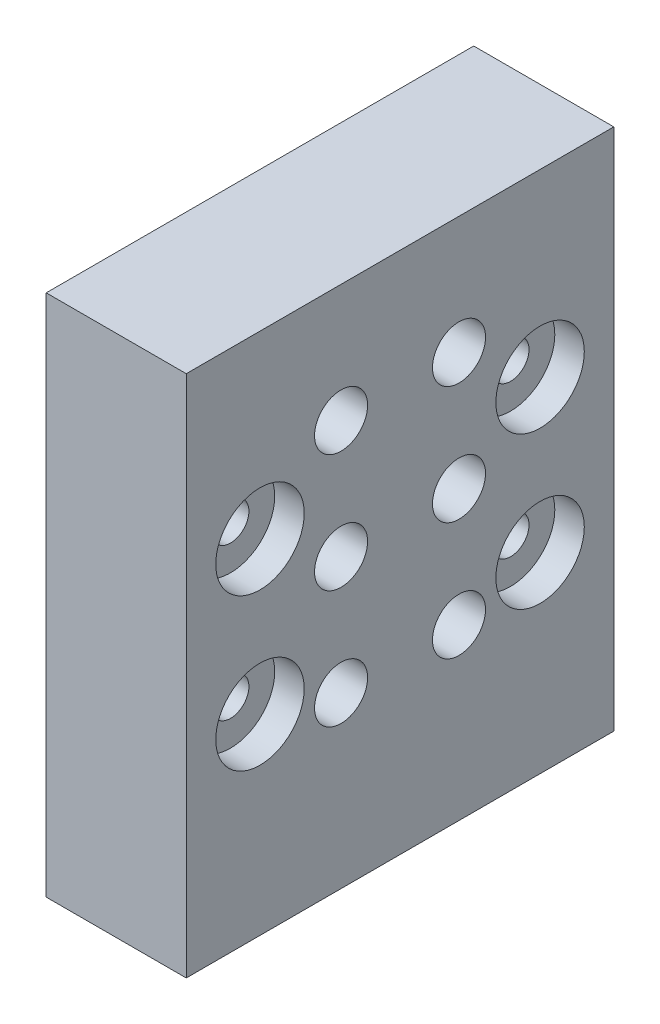
from build123d import *

# Parameters (mm, degrees)
SKETCH_1_W          = 25
SKETCH_1_H          = 31.5
EXTRUDE_1_DEPTH     = 2
SKETCH_2_R          = 1.25
CUT_EXTRUDE_1_DEPTH = 5
SKETCH_3_W          = 2
SKETCH_3_H          = 31.5
EXTRUDE_2_DEPTH     = 2
SKETCH_4_W          = 2
SKETCH_4_H          = 31.5
EXTRUDE_3_DEPTH     = 2
SKETCH_5_W          = 2
SKETCH_5_H          = 31.5
EXTRUDE_4_DEPTH     = 2
SKETCH_6_W          = 2
SKETCH_6_H          = 31.5
EXTRUDE_5_DEPTH     = 2
SKETCH_7_W          = 4
SKETCH_7_H          = 29
EXTRUDE_6_DEPTH     = 2
SKETCH_8_W          = 4
SKETCH_8_H          = 29
EXTRUDE_7_DEPTH     = 2
EXTRUDE_START       = 3
SKETCH_9_W          = 29
SKETCH_9_H          = 35.5
SKETCH_9_R          = 1.25
EXTRUDE_8_DEPTH     = 3
EXTRUDE_START_2     = 2.5
SKETCH_11_W         = 29
SKETCH_11_H         = 35.5
SKETCH_11_R         = 1.25
EXTRUDE_9_DEPTH     = 2.5
SKETCH_12_R         = 1.8
CUT_EXTRUDE_2_DEPTH = 13.5
SKETCH_13_R         = 3
CUT_EXTRUDE_3_DEPTH = 2


with BuildPart() as part:
    # 草圖1 → 填料-伸長1 (new body)
    with BuildSketch(Plane(origin=(0, 0, 0), x_dir=(0, 0, -1), z_dir=(1, 0, 0))):
        with Locations((12.5, 15.75)):
            Rectangle(SKETCH_1_W, SKETCH_1_H)
    extrude(amount=EXTRUDE_1_DEPTH)

    # 草圖2 → 除料-伸長1 (cut)
    with BuildSketch(Plane(origin=(2, 0, 0), x_dir=(0, 0, -1), z_dir=(1, 0, 0))):
        with Locations((22, 21.3)):
            Circle(SKETCH_2_R)
        with Locations((22, 11)):
            Circle(SKETCH_2_R)
        with Locations((3, 21.3)):
            Circle(SKETCH_2_R)
        with Locations((3, 11)):
            Circle(SKETCH_2_R)
    extrude(amount=-CUT_EXTRUDE_1_DEPTH, mode=Mode.SUBTRACT)

    # 草圖3 → 填料-伸長2 (add)
    with BuildSketch(Plane.XY):
        with Locations((1, 15.75)):
            Rectangle(SKETCH_3_W, SKETCH_3_H)
    extrude(amount=EXTRUDE_2_DEPTH)

    # 草圖4 → 填料-伸長3 (add)
    with BuildSketch(Plane(origin=(0, 0, -25), x_dir=(-1, 0, 0), z_dir=(0, 0, -1))):
        with Locations((-1, 15.75)):
            Rectangle(SKETCH_4_W, SKETCH_4_H)
    extrude(amount=EXTRUDE_3_DEPTH)

    # 草圖5 → 填料-伸長4 (add)
    with BuildSketch(Plane.ZY):
        with Locations((-26, 15.75)):
            Rectangle(SKETCH_5_W, SKETCH_5_H)
    extrude(amount=EXTRUDE_4_DEPTH)

    # 草圖6 → 填料-伸長5 (add)
    with BuildSketch(Plane.ZY):
        with Locations((1, 15.75)):
            Rectangle(SKETCH_6_W, SKETCH_6_H)
    extrude(amount=EXTRUDE_5_DEPTH)

    # 草圖7 → 填料-伸長6 (add)
    with BuildSketch(Plane(origin=(0, 31.5, 0), x_dir=(1, 0, 0), z_dir=(0, 1, 0))):
        with Locations((0, 12.5)):
            Rectangle(SKETCH_7_W, SKETCH_7_H)
    extrude(amount=EXTRUDE_6_DEPTH)

    # 草圖8 → 填料-伸長7 (add)
    with BuildSketch(Plane(origin=(0, 0, 0), x_dir=(-1, 0, 0), z_dir=(0, -1, 0))):
        with Locations((0, 12.5)):
            Rectangle(SKETCH_8_W, SKETCH_8_H)
    extrude(amount=EXTRUDE_7_DEPTH)

    # 草圖9 → 填料-伸長8 (add)
    with BuildSketch(Plane(origin=(2, 0, 0), x_dir=(0, 0, -1), z_dir=(1, 0, 0)).offset(EXTRUDE_START)):
        with Locations((12.5, 15.75)):
            Rectangle(SKETCH_9_W, SKETCH_9_H)
        with Locations((3, 21.3)):
            Circle(SKETCH_9_R, mode=Mode.SUBTRACT)
        with Locations((22, 21.3)):
            Circle(SKETCH_9_R, mode=Mode.SUBTRACT)
        with Locations((22, 11)):
            Circle(SKETCH_9_R, mode=Mode.SUBTRACT)
        with Locations((3, 11)):
            Circle(SKETCH_9_R, mode=Mode.SUBTRACT)
    extrude(amount=-EXTRUDE_8_DEPTH)

    # 草圖11 → 填料-伸長9 (add)
    with BuildSketch(Plane(origin=(5, 0, 0), x_dir=(0, 0, -1), z_dir=(1, 0, 0)).offset(EXTRUDE_START_2)):
        with Locations((12.5, 15.75)):
            Rectangle(SKETCH_11_W, SKETCH_11_H)
        with Locations((3, 21.3)):
            Circle(SKETCH_11_R, mode=Mode.SUBTRACT)
        with Locations((22, 21.3)):
            Circle(SKETCH_11_R, mode=Mode.SUBTRACT)
        with Locations((22, 11)):
            Circle(SKETCH_11_R, mode=Mode.SUBTRACT)
        with Locations((3, 11)):
            Circle(SKETCH_11_R, mode=Mode.SUBTRACT)
    extrude(amount=-EXTRUDE_9_DEPTH)

    # 草圖12 → 除料-伸長2 (cut)
    with BuildSketch(Plane(origin=(7.5, 0, 0), x_dir=(0, 0, -1), z_dir=(1, 0, 0))):
        with Locations((8.5, 25.5)):
            Circle(SKETCH_12_R)
        with Locations((16.5, 25.5)):
            Circle(SKETCH_12_R)
        with Locations((16.5, 17.5)):
            Circle(SKETCH_12_R)
        with Locations((16.5, 9.5)):
            Circle(SKETCH_12_R)
        with Locations((8.5, 9.5)):
            Circle(SKETCH_12_R)
        with Locations((8.5, 17.5)):
            Circle(SKETCH_12_R)
    extrude(amount=-CUT_EXTRUDE_2_DEPTH, mode=Mode.SUBTRACT)

    # 草圖13 → 除料-伸長3 (cut)
    with BuildSketch(Plane(origin=(7.5, 0, 0), x_dir=(0, 0, -1), z_dir=(1, 0, 0))):
        with Locations((3, 21.3)):
            Circle(SKETCH_13_R)
        with Locations((3, 11)):
            Circle(SKETCH_13_R)
        with Locations((22, 11)):
            Circle(SKETCH_13_R)
        with Locations((22, 21.3)):
            Circle(SKETCH_13_R)
    extrude(amount=-CUT_EXTRUDE_3_DEPTH, mode=Mode.SUBTRACT)


solid = part.part
